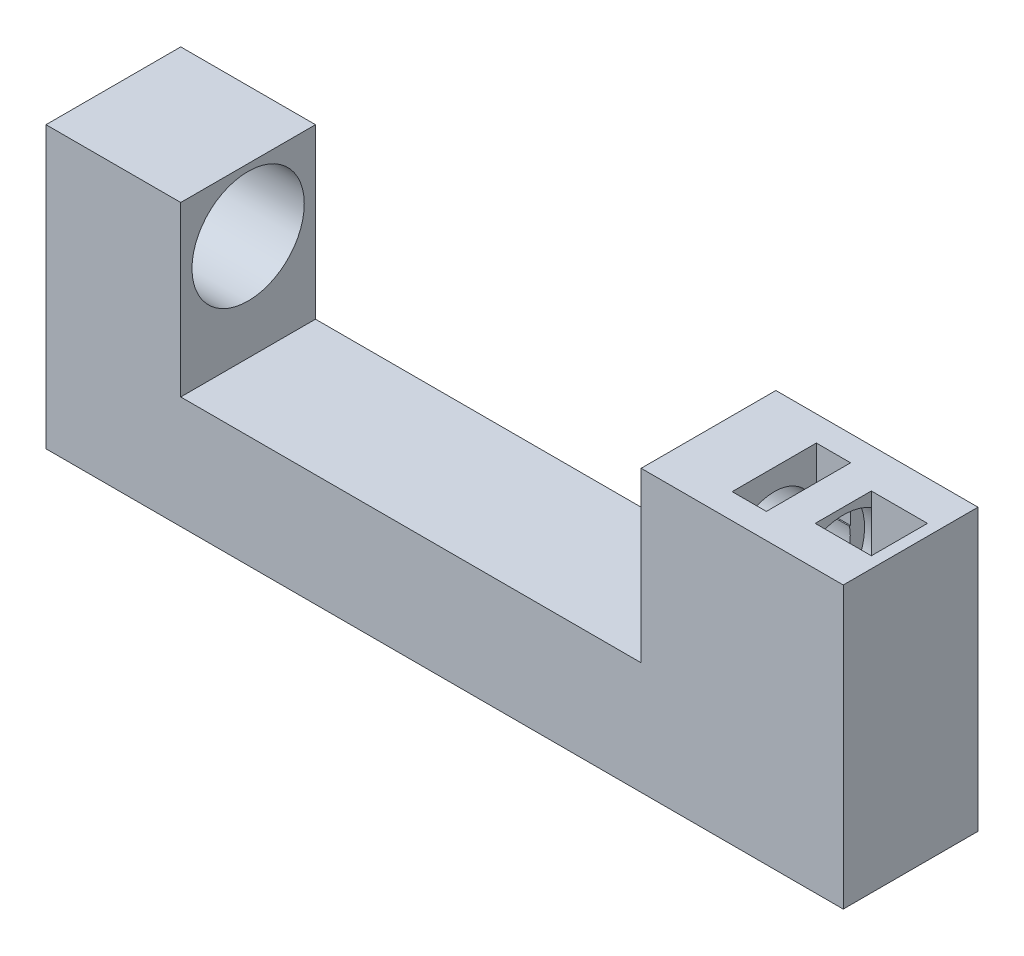
from build123d import *

# Parameters (mm, degrees)
SKETCH1_W           = 65
SKETCH1_H           = 12
BOSS_EXTRUDE1_DEPTH = 25
SKETCH2_R           = 5
CUT_EXTRUDE1_DEPTH  = 70.899928469
SKETCH3_W           = 41
SKETCH3_H           = 12
CUT_EXTRUDE2_DEPTH  = 15
BOSS_EXTRUDE2_START = -3.1
SKETCH5_R           = 5
SKETCH5_R_2         = 3.725
BOSS_EXTRUDE2_DEPTH = 8.9
SKETCH4_W           = 3.0500066
SKETCH4_H           = 7.5
CUT_EXTRUDE3_DEPTH  = 4.84
BOSS_EXTRUDE5_START = 6
BOSS_EXTRUDE5_DEPTH = 6
SKETCH13_W          = 1
SKETCH13_H          = 5
BOSS_EXTRUDE6_DEPTH = 11.106510599
SKETCH14_W          = 5
SKETCH14_H          = 5
BOSS_EXTRUDE7_DEPTH = 4.491999938


with BuildPart() as part:
    # Sketch1 → Boss-Extrude1 (new body)
    with BuildSketch(Plane(origin=(0, 0, 0), x_dir=(1, 0, 0), z_dir=(0, 1, 0))):
        Rectangle(SKETCH1_W, SKETCH1_H)
    extrude(amount=BOSS_EXTRUDE1_DEPTH)

    # Sketch2 → Cut-Extrude1 (cut, through all)
    with BuildSketch(Plane(origin=(32.5, 0, 0), x_dir=(0, 0, -1), z_dir=(1, 0, 0))):
        with Locations((0, 19.399202688)):
            Circle(SKETCH2_R)
    extrude(amount=-CUT_EXTRUDE1_DEPTH, mode=Mode.SUBTRACT)

    # Sketch3 → Cut-Extrude2 (cut)
    with BuildSketch(Plane(origin=(0, 25, 0), x_dir=(1, 0, 0), z_dir=(0, 1, 0))):
        Rectangle(SKETCH3_W, SKETCH3_H)
    extrude(amount=-CUT_EXTRUDE2_DEPTH, mode=Mode.SUBTRACT)

    # Sketch5 → Boss-Extrude2 (add)
    with BuildSketch(Plane(origin=(32.5, 0, 0), x_dir=(0, 0, -1), z_dir=(1, 0, 0)).offset(BOSS_EXTRUDE2_START)):
        with Locations((0, 19.399202688)):
            Circle(SKETCH5_R)
        with Locations((0, 19.399202688)):
            Circle(SKETCH5_R_2, mode=Mode.SUBTRACT)
    extrude(amount=-BOSS_EXTRUDE2_DEPTH)

    # Sketch4 → Cut-Extrude3 (cut)
    with BuildSketch(Plane(origin=(0, 25, 0), x_dir=(1, 0, 0), z_dir=(0, 1, 0))):
        with Locations((27.88, 0)):
            Rectangle(SKETCH4_W, SKETCH4_H)
    extrude(amount=-CUT_EXTRUDE3_DEPTH, mode=Mode.SUBTRACT)

    # Sketch12 → Boss-Extrude5 (add)
    with BuildSketch(Plane(origin=(32.5, 0, 0), x_dir=(0, 0, -1), z_dir=(1, 0, 0)).offset(BOSS_EXTRUDE5_START)):
        with BuildLine():
            Line((-2.5, 25), (-6, 25))
            Line((-6, 25), (-6, 0))
            Line((-6, 0), (6, 0))
            Line((6, 0), (6, 25))
            Line((6, 25), (2.5, 25))
            Line((2.5, 25), (2.5, 23.729329707))
            ThreePointArc((2.5, 23.729329707), (4.330127019, 21.899202688), (5, 19.399202688))
            ThreePointArc((5, 19.399202688), (4.330127019, 16.899202688), (2.5, 15.069075669))
            Line((2.5, 15.069075669), (2.5, 13.893489401))
            Line((2.5, 13.893489401), (-2.5, 13.893489401))
            Line((-2.5, 13.893489401), (-2.5, 15.069075669))
            ThreePointArc((-2.5, 15.069075669), (-5, 19.399202688), (-2.5, 23.729329707))
            Line((-2.5, 23.729329707), (-2.5, 25))
        make_face()
        with BuildLine():
            Line((-2.5, 15.069075669), (-2.5, 23.729329707))
            ThreePointArc((-2.5, 23.729329707), (-5, 19.399202688), (-2.5, 15.069075669))
        make_face()
        with BuildLine():
            ThreePointArc((5, 19.399202688), (4.330127019, 21.899202688), (2.5, 23.729329707))
            Line((2.5, 23.729329707), (2.5, 15.069075669))
            ThreePointArc((2.5, 15.069075669), (4.330127019, 16.899202688), (5, 19.399202688))
        make_face()
    extrude(amount=-BOSS_EXTRUDE5_DEPTH)

    # Sketch13 → Boss-Extrude6 (add)
    with BuildSketch(Plane(origin=(0, 25, 0), x_dir=(1, 0, 0), z_dir=(0, 1, 0))):
        with Locations((38, 0)):
            Rectangle(SKETCH13_W, SKETCH13_H)
    extrude(amount=-BOSS_EXTRUDE6_DEPTH)

    # Sketch14 → Boss-Extrude7 (add)
    with BuildSketch(Plane(origin=(0, 13.893489401, 0), x_dir=(1, 0, 0), z_dir=(0, 1, 0))):
        with Locations((35, 0)):
            Rectangle(SKETCH14_W, SKETCH14_H)
    extrude(amount=BOSS_EXTRUDE7_DEPTH)


solid = part.part
